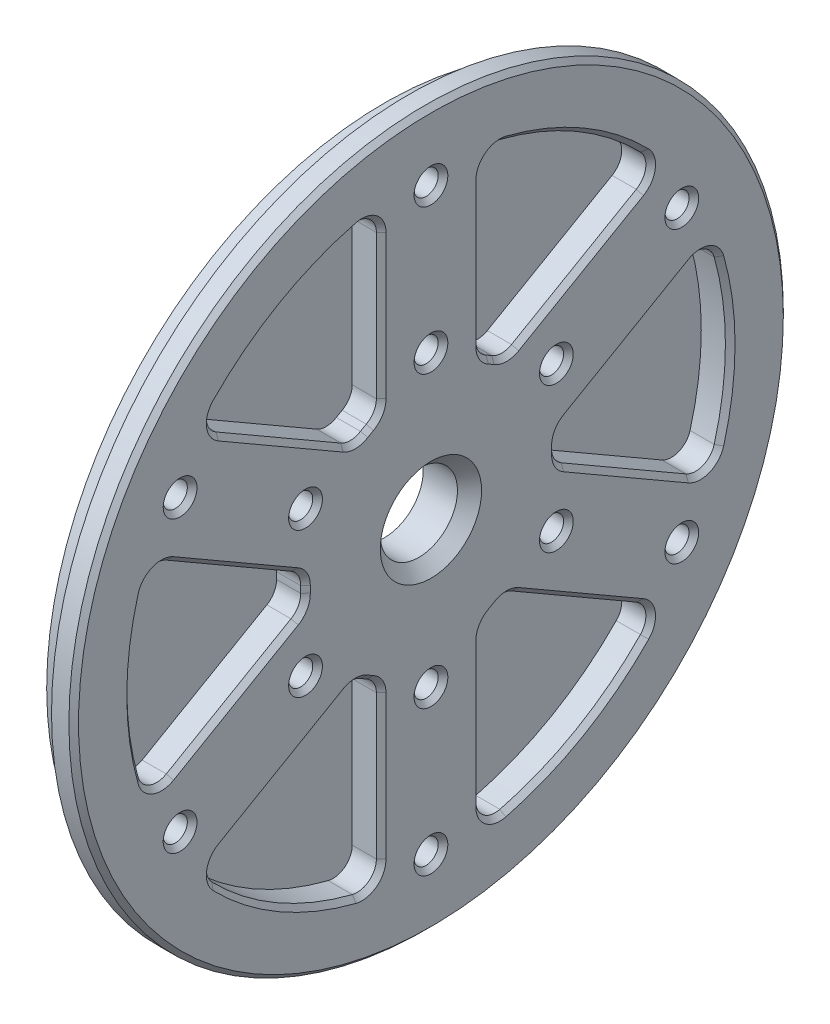
from build123d import *

# Parameters (mm, degrees)
SKETCH1_R                    = 37
BOSS_EXTRUDE1_DEPTH          = 1.4
SKETCH2_R                    = 1.25
CUT_EXTRUDE1_DEPTH           = 3
CHAMFER1_SIZE                = 0.5
CIRPATTERN1_COUNT            = 6
CHAMFER1_OF_CIRPATTERN1_SIZE = 0.5
CHAMFER2_SIZE                = 0.5
SKETCH3_R                    = 1.25
CUT_EXTRUDE2_DEPTH           = 3
CHAMFER3_SIZE                = 0.5
CIRPATTERN2_COUNT            = 6
CHAMFER3_OF_CIRPATTERN2_SIZE = 0.5
SKETCH4_R                    = 4
CUT_EXTRUDE3_DEPTH           = 2.8
CHAMFER4_SIZE                = 1.25
SKETCH5_R                    = 35
SKETCH5_R_2                  = 4
BOSS_EXTRUDE2_DEPTH          = 2
CUT_EXTRUDE4_START           = -0.5
SKETCH6_R                    = 37
SKETCH6_R_2                  = 35
CUT_EXTRUDE4_DEPTH           = 0.5
CUT_EXTRUDE5_DEPTH           = 3
CHAMFER5_SIZE                = 0.5
CIRPATTERN3_COUNT            = 6
CHAMFER5_OF_CIRPATTERN3_SIZE = 0.5
SKETCH2_2_R                  = 1.25
CUT_EXTRUDE6_DEPTH           = 3
CIRPATTERN4_COUNT            = 6


with BuildPart() as part:
    # Sketch1 → Boss-Extrude1 (new, symmetric)
    with BuildSketch(Plane(origin=(0, 0, 0), x_dir=(0, 0, -1), z_dir=(1, 0, 0))):
        Circle(SKETCH1_R)
    extrude(amount=BOSS_EXTRUDE1_DEPTH, both=True)

    # Sketch2 → Cut-Extrude1 (cut)
    with BuildSketch(Plane(origin=(1.4, 0, 0), x_dir=(0, 0, -1), z_dir=(1, 0, 0))):
        with Locations((0, 30)):
            Circle(SKETCH2_R)
    cut_extrude1 = extrude(amount=-CUT_EXTRUDE1_DEPTH, mode=Mode.SUBTRACT)

    # Chamfer1
    chamfer1_edges = [part.edges().sort_by_distance(p)[0] for p in [
        (1.4, 30, 1.25),
    ]]
    chamfer(chamfer1_edges, length=CHAMFER1_SIZE)

    # CirPattern1: Cut-Extrude1 ×6 about axis
    cirpattern1_axis = Axis((0, 0, 0), (1, 0, 0))
    for i in range(1, CIRPATTERN1_COUNT):
        add(cut_extrude1.rotate(cirpattern1_axis, i * 360 / CIRPATTERN1_COUNT), mode=Mode.SUBTRACT)

    # Chamfer1 of CirPattern1
    chamfer1_of_cirpattern1_edges = [part.edges().sort_by_distance(p)[0] for p in [
        (1.4, 13.917468245, 26.605762114),
        (1.4, -16.082531755, 25.355762114),
        (1.4, -30, -1.25),
        (1.4, -13.917468245, -26.605762114),
        (1.4, 16.082531755, -25.355762114),
    ]]
    chamfer(chamfer1_of_cirpattern1_edges, length=CHAMFER1_OF_CIRPATTERN1_SIZE)

    # Chamfer2
    chamfer2_edges = [part.edges().sort_by_distance(p)[0] for p in [
        (1.4, 0, 37),
    ]]
    chamfer(chamfer2_edges, length=CHAMFER2_SIZE)

    # Sketch3 → Cut-Extrude2 (cut)
    with BuildSketch(Plane(origin=(1.4, 0, 0), x_dir=(0, 0, -1), z_dir=(1, 0, 0))):
        with Locations((0, 15)):
            Circle(SKETCH3_R)
    cut_extrude2 = extrude(amount=-CUT_EXTRUDE2_DEPTH, mode=Mode.SUBTRACT)

    # Chamfer3
    chamfer3_edges = [part.edges().sort_by_distance(p)[0] for p in [
        (1.4, 15, 1.25),
    ]]
    chamfer(chamfer3_edges, length=CHAMFER3_SIZE)

    # CirPattern2: Cut-Extrude2 ×6 about axis
    cirpattern2_axis = Axis((0, 0, 0), (1, 0, 0))
    for i in range(1, CIRPATTERN2_COUNT):
        add(cut_extrude2.rotate(cirpattern2_axis, i * 360 / CIRPATTERN2_COUNT), mode=Mode.SUBTRACT)

    # Chamfer3 of CirPattern2
    chamfer3_of_cirpattern2_edges = [part.edges().sort_by_distance(p)[0] for p in [
        (1.4, 6.417468245, 13.615381057),
        (1.4, -8.582531755, 12.365381057),
        (1.4, -15, -1.25),
        (1.4, -6.417468245, -13.615381057),
        (1.4, 8.582531755, -12.365381057),
    ]]
    chamfer(chamfer3_of_cirpattern2_edges, length=CHAMFER3_OF_CIRPATTERN2_SIZE)

    # Sketch4 → Cut-Extrude3 (cut)
    with BuildSketch(Plane(origin=(1.4, 0, 0), x_dir=(0, 0, -1), z_dir=(1, 0, 0))):
        Circle(SKETCH4_R)
    extrude(amount=-CUT_EXTRUDE3_DEPTH, mode=Mode.SUBTRACT)

    # Chamfer4
    chamfer4_edges = [part.edges().sort_by_distance(p)[0] for p in [
        (1.4, 0, 4),
    ]]
    chamfer(chamfer4_edges, length=CHAMFER4_SIZE)

    # Sketch5 → Boss-Extrude2 (add)
    with BuildSketch(Plane.ZY.offset(1.4)):
        Circle(SKETCH5_R)
        with Locations(Location((0, 0, 0), (0, 0, 180))):
            Circle(SKETCH5_R_2, mode=Mode.SUBTRACT)
    extrude(amount=BOSS_EXTRUDE2_DEPTH)

    # Sketch6 → Cut-Extrude4 (cut)
    with BuildSketch(Plane.ZY.offset(1.4).offset(CUT_EXTRUDE4_START)):
        Circle(SKETCH6_R)
        Circle(SKETCH6_R_2, mode=Mode.SUBTRACT)
    extrude(amount=CUT_EXTRUDE4_DEPTH, mode=Mode.SUBTRACT)

    # Sketch7 → Cut-Extrude5 (cut)
    with BuildSketch(Plane(origin=(1.4, 0, 0), x_dir=(0, 0, -1), z_dir=(1, 0, 0))):
        with BuildLine():
            Line((-5.150629559, 13.185920405), (-5.150629559, 28.104599213))
            ThreePointArc((-5.150629559, 28.104599213), (-5.923090095, 29.683569404), (-7.643776425, 30.042847434))
            ThreePointArc((-7.643776425, 30.042847434), (-15.5, 26.846787517), (-22.195980868, 21.641128282))
            ThreePointArc((-22.195980868, 21.641128282), (-22.745180132, 19.971331194), (-21.763982102, 18.51287565))
            Line((-21.763982102, 18.51287565), (-8.844027263, 11.053536246))
            ThreePointArc((-8.844027263, 11.053536246), (-7.817335996, 10.785765167), (-6.798156961, 11.080842113))
            ThreePointArc((-6.798156961, 11.080842113), (-6.5, 11.258330249), (-6.197212284, 11.427797684))
            ThreePointArc((-6.197212284, 11.427797684), (-5.432078636, 12.162894146), (-5.150629559, 13.185920405))
        make_face()
    cut_extrude5 = extrude(amount=-CUT_EXTRUDE5_DEPTH, mode=Mode.SUBTRACT)

    # Chamfer5
    chamfer5_edges = [part.edges().sort_by_distance(p)[0] for p in [
        (1.4, 29.683569404, 5.923090095),
        (1.4, 26.846787517, 15.5),
        (1.4, 19.971331194, 22.745180132),
        (1.4, 14.783205948, 15.304004683),
        (1.4, 10.785765167, 7.817335996),
        (1.4, 11.258330249, 6.5),
        (1.4, 12.162894146, 5.432078636),
        (1.4, 20.645259809, 5.150629559),
    ]]
    chamfer(chamfer5_edges, length=CHAMFER5_SIZE)

    # CirPattern3: Cut-Extrude5 ×6 about axis
    cirpattern3_axis = Axis((0, 0, 0), (1, 0, 0))
    for i in range(1, CIRPATTERN3_COUNT):
        add(cut_extrude5.rotate(cirpattern3_axis, i * 360 / CIRPATTERN3_COUNT), mode=Mode.SUBTRACT)

    # Chamfer5 of CirPattern3
    chamfer5_of_cirpattern3_edges = [part.edges().sort_by_distance(p)[0] for p in [
        (1.4, 9.712238211, 28.668270227),
        (1.4, 0, 31),
        (1.4, -9.712238211, 28.668270227),
        (1.4, -5.862053861, 20.454634241),
        (1.4, -1.377128979, 13.249414632),
        (1.4, 0, 13),
        (1.4, 1.377128979, 13.249414632),
        (1.4, 5.862053861, 20.454634241),
        (1.4, -19.971331194, 22.745180132),
        (1.4, -26.846787517, 15.5),
        (1.4, -29.683569405, 5.923090095),
        (1.4, -20.645259809, 5.150629559),
        (1.4, -12.162894146, 5.432078636),
        (1.4, -11.258330249, 6.5),
        (1.4, -10.785765167, 7.817335996),
        (1.4, -14.783205948, 15.304004683),
        (1.4, -29.683569404, -5.923090095),
        (1.4, -26.846787517, -15.5),
        (1.4, -19.971331194, -22.745180132),
        (1.4, -14.783205948, -15.304004683),
        (1.4, -10.785765167, -7.817335996),
        (1.4, -11.258330249, -6.5),
        (1.4, -12.162894146, -5.432078636),
        (1.4, -20.645259809, -5.150629559),
        (1.4, -9.712238211, -28.668270227),
        (1.4, 0, -31),
        (1.4, 9.712238211, -28.668270227),
        (1.4, 5.862053861, -20.454634241),
        (1.4, 1.377128979, -13.249414632),
        (1.4, 0, -13),
        (1.4, -1.377128979, -13.249414632),
        (1.4, -5.862053861, -20.454634241),
        (1.4, 19.971331194, -22.745180132),
        (1.4, 26.846787517, -15.5),
        (1.4, 29.683569405, -5.923090095),
        (1.4, 20.645259809, -5.150629559),
        (1.4, 12.162894146, -5.432078636),
        (1.4, 11.258330249, -6.5),
        (1.4, 10.785765167, -7.817335996),
        (1.4, 14.783205948, -15.304004683),
    ]]
    chamfer(chamfer5_of_cirpattern3_edges, length=CHAMFER5_OF_CIRPATTERN3_SIZE)

    # Sketch2<2> → Cut-Extrude6 (cut)
    with BuildSketch(Plane(origin=(1.4, 0, 0), x_dir=(0, 0, -1), z_dir=(1, 0, 0))):
        with Locations((0, 30)):
            Circle(SKETCH2_2_R)
    cut_extrude6 = extrude(amount=-CUT_EXTRUDE6_DEPTH, mode=Mode.SUBTRACT)

    # CirPattern4: Cut-Extrude6 ×6 about axis
    cirpattern4_axis = Axis((1.4, 0, 0), (-1, 0, 0))
    for i in range(1, CIRPATTERN4_COUNT):
        add(cut_extrude6.rotate(cirpattern4_axis, i * 360 / CIRPATTERN4_COUNT), mode=Mode.SUBTRACT)


solid = part.part
